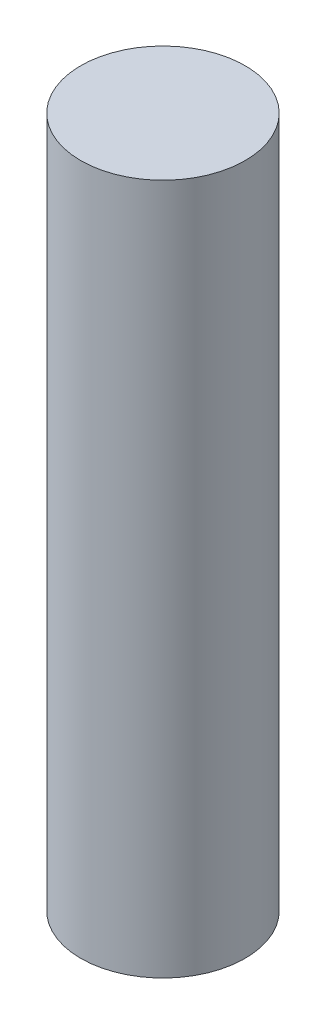
from build123d import *

# Parameters (mm, degrees)
SKETCH1_R           = 11.9
BOSS_EXTRUDE1_DEPTH = 100


with BuildPart() as part:
    # Sketch1 → Boss-Extrude1 (new body)
    with BuildSketch(Plane(origin=(0, 0, 0), x_dir=(1, 0, 0), z_dir=(0, 1, 0))):
        with Locations(Location((0, 0, 0), (0, 0, 270))):
            Circle(SKETCH1_R)
    extrude(amount=BOSS_EXTRUDE1_DEPTH)


solid = part.part
